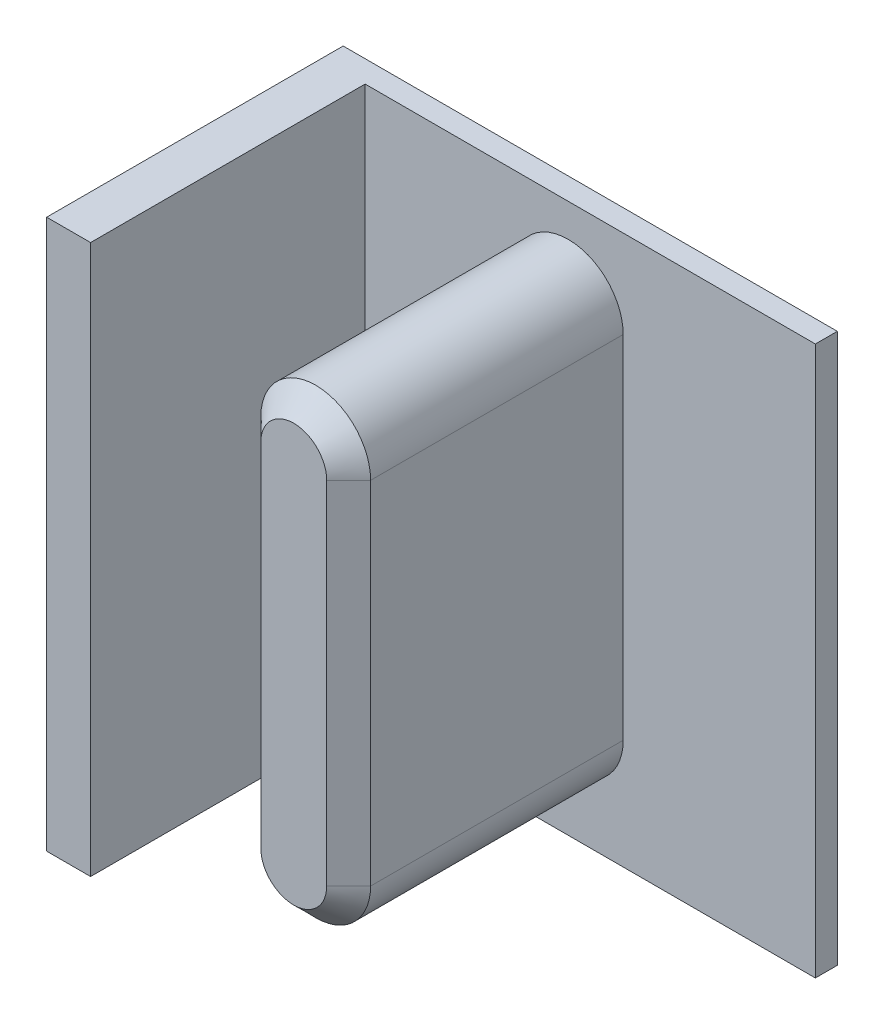
from build123d import *

# Parameters (mm, degrees)
SKETCH1_W           = 9
SKETCH1_H           = 10
BOSS_EXTRUDE1_DEPTH = 0.4
BOSS_EXTRUDE2_DEPTH = 5
SKETCH4_W           = 0.8
SKETCH4_H           = 10
BOSS_EXTRUDE3_DEPTH = 5
CHAMFER1_SIZE       = 0.4


with BuildPart() as part:
    # Sketch1 → Boss-Extrude1 (new body)
    with BuildSketch(Plane.XY):
        with Locations((4.5, 5)):
            Rectangle(SKETCH1_W, SKETCH1_H)
    extrude(amount=BOSS_EXTRUDE1_DEPTH)

    # Sketch3 → Boss-Extrude2 (add)
    with BuildSketch(Plane.XY.offset(0.4)):
        with BuildLine():
            Line((3.5, 2), (3.5, 8.4))
            ThreePointArc((3.5, 8.4), (4.5, 9.4), (5.5, 8.4))
            Line((5.5, 8.4), (5.5, 2))
            ThreePointArc((5.5, 2), (4.5, 1), (3.5, 2))
        make_face()
    extrude(amount=BOSS_EXTRUDE2_DEPTH)

    # Sketch4 → Boss-Extrude3 (add)
    with BuildSketch(Plane.XY.offset(0.4)):
        with Locations((0.4, 5)):
            Rectangle(SKETCH4_W, SKETCH4_H)
    extrude(amount=BOSS_EXTRUDE3_DEPTH)

    # Chamfer1
    chamfer1_edges = [part.edges().sort_by_distance(p)[0] for p in [
        (4.5, 1, 5.4),
        (5.5, 5.2, 5.4),
        (4.5, 9.4, 5.4),
        (3.5, 5.2, 5.4),
    ]]
    chamfer(chamfer1_edges, length=CHAMFER1_SIZE)


solid = part.part
